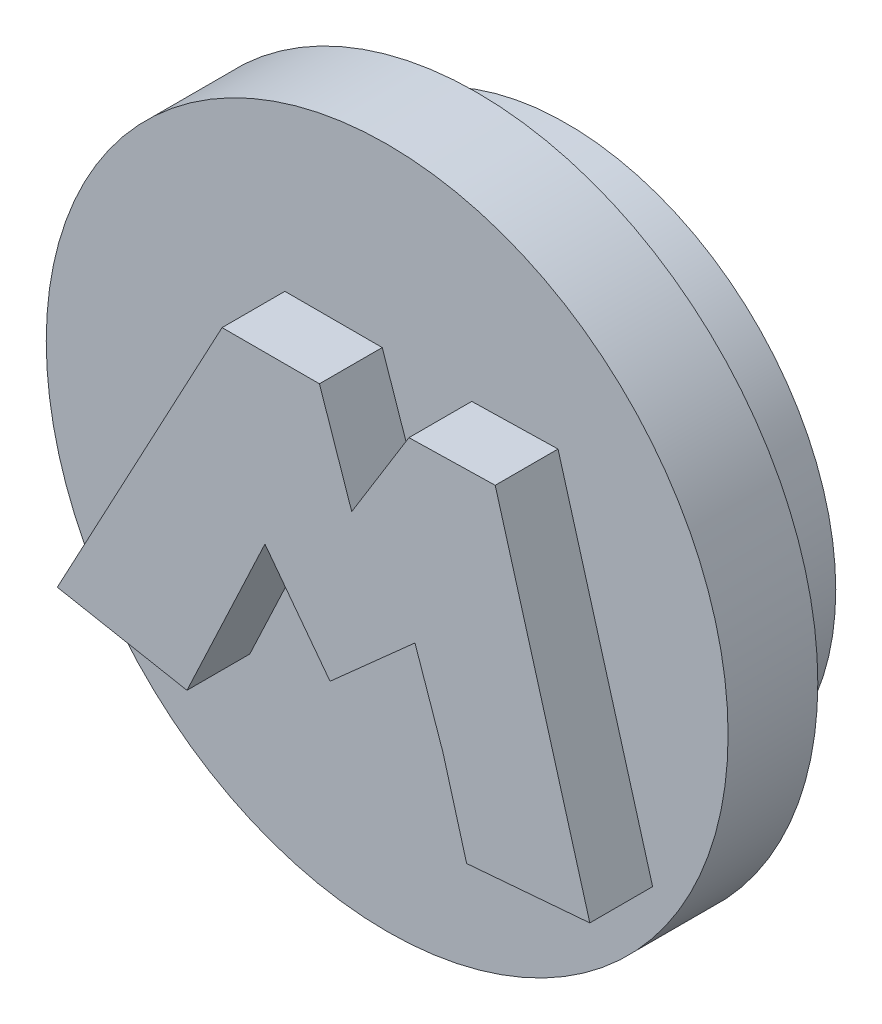
from build123d import *

# Parameters (mm, degrees)
ESBO_O1_R                = 19
RESSALTO_EXTRUS_O1_DEPTH = 2.5
ESBO_O2_R                = 15
RESSALTO_EXTRUS_O2_DEPTH = 5
RESSALTO_EXTRUS_O3_DEPTH = 3.5


with BuildPart() as part:
    # Esboço1 → Ressalto-extrusão1 (new, symmetric)
    with BuildSketch(Plane.XY):
        Circle(ESBO_O1_R)
    extrude(amount=RESSALTO_EXTRUS_O1_DEPTH, both=True)

    # Esboço2 → Ressalto-extrusão2 (add)
    with BuildSketch(Plane(origin=(0, 0, -2.5), x_dir=(-1, 0, 0), z_dir=(0, 0, -1))):
        Circle(ESBO_O2_R)
    extrude(amount=RESSALTO_EXTRUS_O2_DEPTH)

    # Esboço4 → Ressalto-extrusão3 (add)
    with BuildSketch(Plane.XY.offset(2.5)):
        Polygon((-14.8828125, -8.072675781), (-5.700117187, 9.05), (-0.275332031, 9.05), (1.525488281, 3.781484375), (4.714130859, 8.945820312), (9.521279297, 9.05), (14.793515625, -9.434453125), (7.928818359, -10), (6.615410156, -5.319355469), (5.048994141, -0.794980469), (0.316259766, -5.010537109), (-3.311425781, -0.203388672), (-7.657207031, -9.434453125), align=None)
    extrude(amount=RESSALTO_EXTRUS_O3_DEPTH)


solid = part.part
